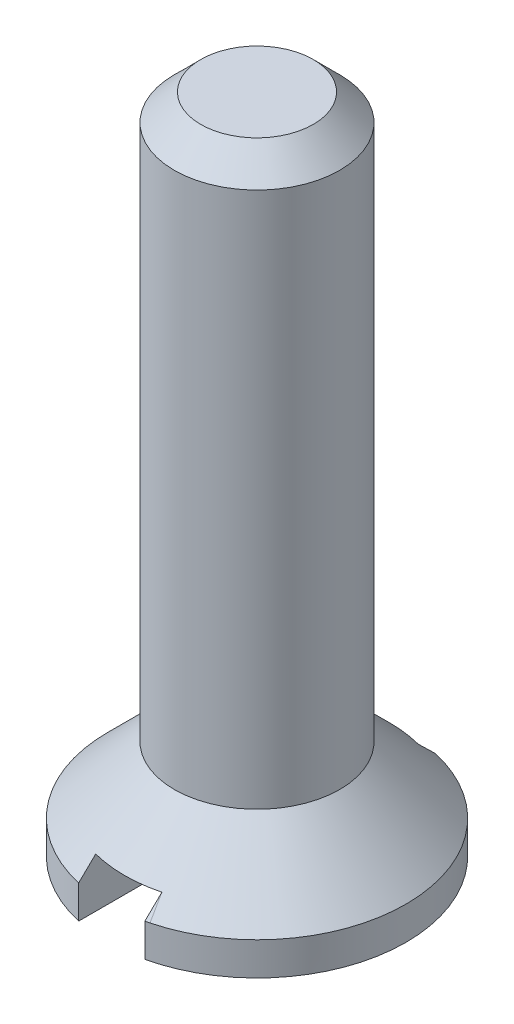
from build123d import *

# Parameters (mm, degrees)
SKETCH_1_W          = 1.25
SKETCH_1_H          = 8.5
SKETCH_2_W          = 1
SKETCH_2_H          = 0.75
CUT_EXTRUDE_1_DEPTH = 10
CHAMFER_1_SIZE      = 0.4


with BuildPart() as part:
    # Эскиз1 → Повернуть1 (revolve)
    with BuildSketch(Plane.XY):
        with Locations((-0.625, 5.75)):
            Rectangle(SKETCH_1_W, SKETCH_1_H)
        Polygon((-2.25, 0), (0, 0), (0, 1.5), (-1.25, 1.5), (-2.25, 0.5), align=None)
    revolve(axis=Axis((0, 10, 0), (0, -1, 0)))

    # Эскиз2 → Вырез-Вытянуть1 (cut, symmetric)
    with BuildSketch(Plane.XY):
        with Locations((0, 0.375)):
            Rectangle(SKETCH_2_W, SKETCH_2_H)
    extrude(amount=CUT_EXTRUDE_1_DEPTH, both=True, mode=Mode.SUBTRACT)

    # Фаска1
    chamfer_1_edges = [part.edges().sort_by_distance(p)[0] for p in [
        (1.25, 10, 0),
    ]]
    chamfer(chamfer_1_edges, length=CHAMFER_1_SIZE)


solid = part.part
